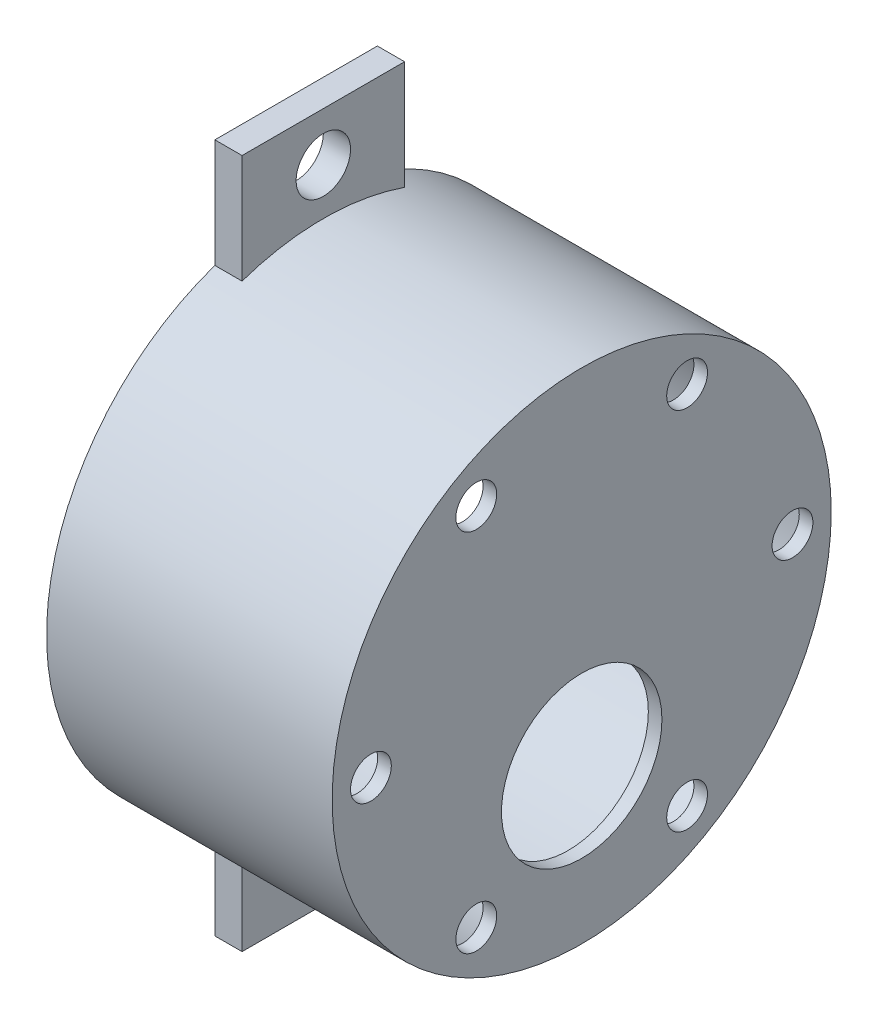
from build123d import *

# Parameters (mm, degrees)
SKETCH1_R           = 18.35
BOSS_EXTRUDE1_DEPTH = 21
SHELL1_T            = -1
SKETCH3_R           = 1.5
CUT_EXTRUDE2_DEPTH  = 1
CIRPATTERN1_COUNT   = 6
SKETCH4_R           = 5.9
CUT_EXTRUDE3_DEPTH  = 10
SKETCH5_W           = 11.949895398
SKETCH5_H           = 8
BOSS_EXTRUDE2_DEPTH = 2
SKETCH6_R           = 2
CUT_EXTRUDE4_DEPTH  = 2


with BuildPart() as part:
    # Sketch1 → Boss-Extrude1 (new body)
    with BuildSketch(Plane(origin=(0, 0, 0), x_dir=(0, 0, -1), z_dir=(1, 0, 0))):
        Circle(SKETCH1_R)
    extrude(amount=-BOSS_EXTRUDE1_DEPTH)

    # Shell1
    shell1_openings = [part.faces().sort_by_distance(p)[0] for p in [
        (-21, 0, 0),
    ]]
    offset(amount=SHELL1_T, openings=shell1_openings, kind=Kind.INTERSECTION)

    # Sketch3 → Cut-Extrude2 (cut)
    with BuildSketch(Plane(origin=(0, 0, 0), x_dir=(0, 0, -1), z_dir=(1, 0, 0))):
        with Locations((-7.75, 13.423393759)):
            Circle(SKETCH3_R)
    cut_extrude2 = extrude(amount=-CUT_EXTRUDE2_DEPTH, mode=Mode.SUBTRACT)

    # CirPattern1: Cut-Extrude2 ×6 about axis
    cirpattern1_axis = Axis((0, 0, 0), (1, 0, 0))
    for i in range(1, CIRPATTERN1_COUNT):
        add(cut_extrude2.rotate(cirpattern1_axis, i * 360 / CIRPATTERN1_COUNT), mode=Mode.SUBTRACT)

    # Sketch4 → Cut-Extrude3 (cut)
    with BuildSketch(Plane(origin=(0, 0, 0), x_dir=(0, 0, -1), z_dir=(1, 0, 0))):
        with Locations((0, -7)):
            Circle(SKETCH4_R)
    extrude(amount=-CUT_EXTRUDE3_DEPTH, mode=Mode.SUBTRACT)

    # Sketch5 → Boss-Extrude2 (add)
    with BuildSketch(Plane.ZY.offset(21)):
        with Locations((0, 21.35)):
            Rectangle(SKETCH5_W, SKETCH5_H)
    boss_extrude2 = extrude(amount=-BOSS_EXTRUDE2_DEPTH)

    # Sketch6 → Cut-Extrude4 (cut)
    with BuildSketch(Plane(origin=(-19, 0, 0), x_dir=(0, 0, -1), z_dir=(1, 0, 0))):
        with Locations((0, 21.763901495)):
            Circle(SKETCH6_R)
    cut_extrude4 = extrude(amount=-CUT_EXTRUDE4_DEPTH, mode=Mode.SUBTRACT)

    # Mirror1: Boss-Extrude2, Cut-Extrude4 across plane
    add(boss_extrude2.mirror(Plane.ZX))
    add(cut_extrude4.mirror(Plane.ZX), mode=Mode.SUBTRACT)


solid = part.part
